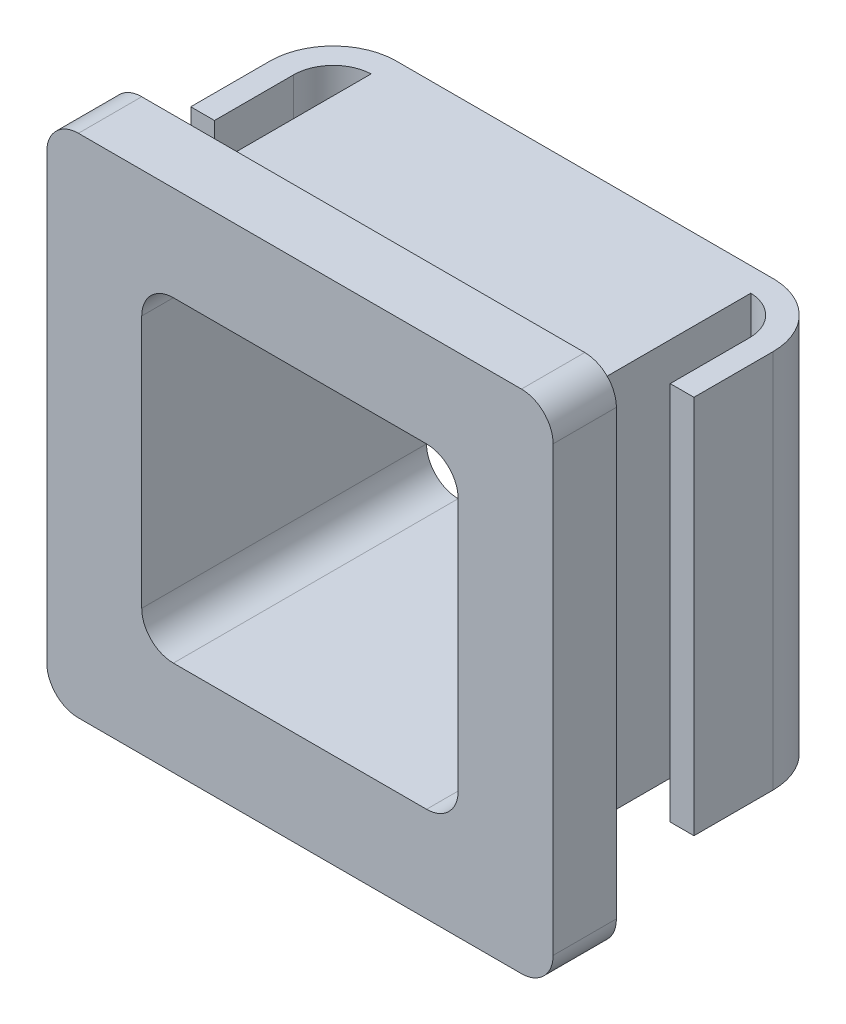
from build123d import *

# Parameters (mm, degrees)
SKETCH1_W           = 16
SKETCH1_H           = 16
SKETCH1_W_2         = 10
SKETCH1_H_2         = 10
BOSS_EXTRUDE1_DEPTH = 2
SKETCH2_W           = 12
SKETCH2_H           = 12
SKETCH2_W_2         = 10
SKETCH2_H_2         = 10
BOSS_EXTRUDE2_DEPTH = 7
BOSS_EXTRUDE3_DEPTH = 12
FILLET1_R           = 1


with BuildPart() as part:
    # Sketch1 → Boss-Extrude1 (new body)
    with BuildSketch(Plane.XY):
        Rectangle(SKETCH1_W, SKETCH1_H)
        Rectangle(SKETCH1_W_2, SKETCH1_H_2, mode=Mode.SUBTRACT)
    extrude(amount=BOSS_EXTRUDE1_DEPTH)

    # Sketch2 → Boss-Extrude2 (add)
    with BuildSketch(Plane.XY):
        Rectangle(SKETCH2_W, SKETCH2_H)
        Rectangle(SKETCH2_W_2, SKETCH2_H_2, mode=Mode.SUBTRACT)
    extrude(amount=-BOSS_EXTRUDE2_DEPTH)

    # Sketch3 → Boss-Extrude3 (add)
    with BuildSketch(Plane(origin=(0, 6, 0), x_dir=(1, 0, 0), z_dir=(0, 1, 0))):
        with BuildLine():
            Line((-6, 7), (-6, 6.249625002))
            ThreePointArc((-6, 6.249625002), (-6.851829776, 5.866467368), (-7.200624902, 5))
            Line((-7.200624902, 5), (-7.200624902, 2.5))
            Line((-7.200624902, 2.5), (-7.950624902, 2.5))
            Line((-7.950624902, 2.5), (-7.950624902, 5))
            ThreePointArc((-7.950624902, 5), (-7.382224013, 6.396865912), (-6, 7))
        make_face()
    boss_extrude3 = extrude(amount=-BOSS_EXTRUDE3_DEPTH)

    # Mirror1: Boss-Extrude3 across plane
    add(boss_extrude3.mirror(Plane(origin=(0, 0, 0), x_dir=(0, 0, 1), z_dir=(1, 0, 0))))

    # Fillet1
    fillet1_edges = [part.edges().sort_by_distance(p)[0] for p in [
        (5, -5, -2.5),
        (5, 5, -2.5),
        (-5, 5, -2.5),
        (-5, -5, -2.5),
        (6, 0, -7),
        (-6, 0, -7),
        (8, -8, 1),
        (-8, -8, 1),
        (-8, 8, 1),
        (8, 8, 1),
    ]]
    fillet(fillet1_edges, radius=FILLET1_R)


solid = part.part
